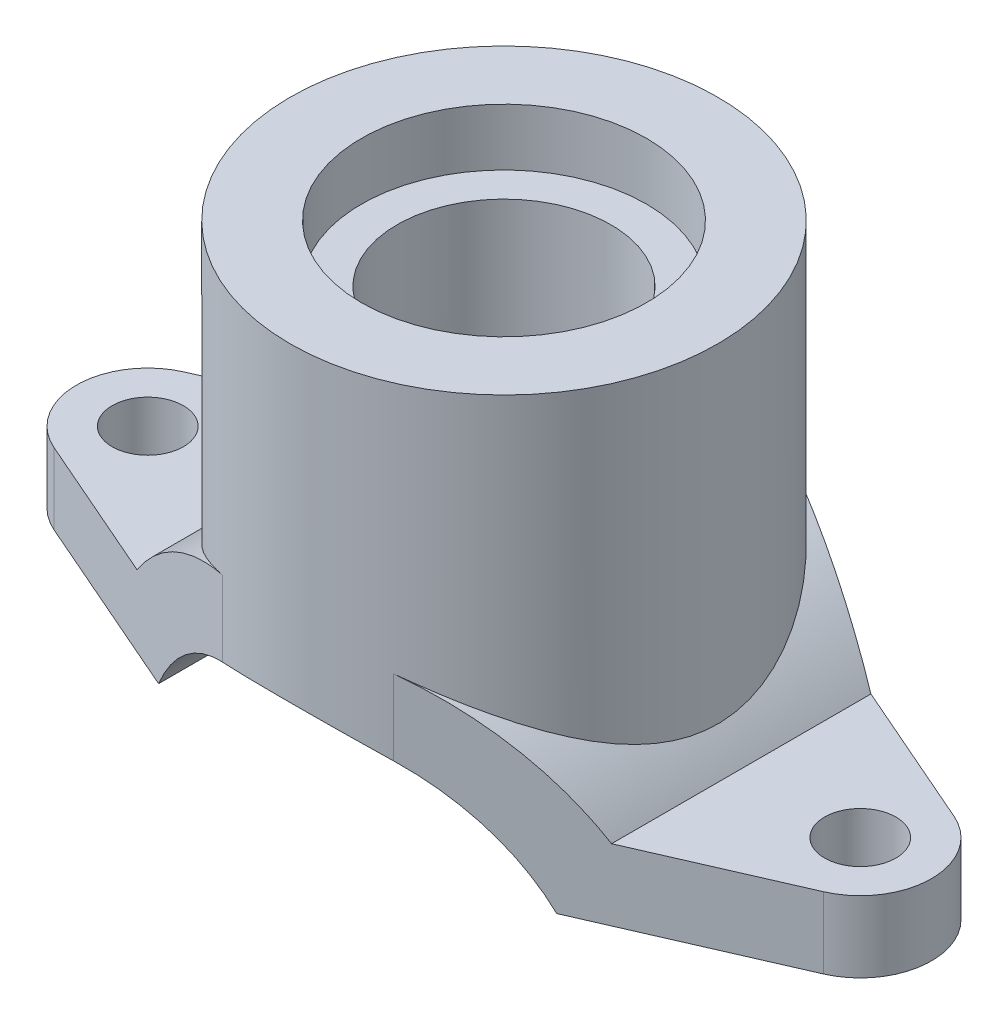
from build123d import *

# Parameters (mm, degrees)
BOSS_EXTRUDE3_DEPTH = 75
SKETCH2_OUTSIDE_W   = 370.368
SKETCH2_OUTSIDE_H   = 220.368
SKETCH2_OUTSIDE_R   = 12.5
CUT_EXTRUDE1_DEPTH  = 150
BOSS_EXTRUDE4_REACH = 227
SKETCH3_R           = 75
SKETCH4_R           = 37.5
CUT_EXTRUDE2_DEPTH  = 150
SKETCH4_4_R         = 50
SKETCH4_4_R_2       = 37.5
CUT_EXTRUDE3_DEPTH  = 20


with BuildPart() as part:
    # Sketch1 → Boss-Extrude3 (new, symmetric)
    with BuildSketch(Plane.XY):
        with BuildLine():
            Line((-150, 25), (-150, 0))
            Line((-150, 0), (-69.84983894, 0))
            ThreePointArc((-69.84983894, 0), (0, 41), (69.84983894, 0))
            Line((69.84983894, 0), (150, 0))
            Line((150, 0), (150, 25))
            Line((150, 25), (83.240615087, 25))
            ThreePointArc((83.240615087, 25), (0, 66), (-83.240615087, 25))
            Line((-83.240615087, 25), (-150, 25))
        make_face()
    extrude(amount=BOSS_EXTRUDE3_DEPTH, both=True)

    # Sketch2 outside → Cut-Extrude1 (cut)
    # profile 1 of 3: a face of its own
    with BuildSketch(Plane(origin=(0, 0, 0), x_dir=(1, 0, 0), z_dir=(0, 1, 0))):
        Rectangle(SKETCH2_OUTSIDE_W, SKETCH2_OUTSIDE_H)
        with BuildLine():
            Line((-135, -22.912878475), (-30, -68.738635424))
            ThreePointArc((-30, -68.738635424), (0, -75), (30, -68.738635424))
            Line((30, -68.738635424), (135, -22.912878475))
            ThreePointArc((135, -22.912878475), (150, 0), (135, 22.912878475))
            Line((135, 22.912878475), (30, 68.738635424))
            ThreePointArc((30, 68.738635424), (0, 75), (-30, 68.738635424))
            Line((-30, 68.738635424), (-135, 22.912878475))
            ThreePointArc((-135, 22.912878475), (-150, 0), (-135, -22.912878475))
        make_face(mode=Mode.SUBTRACT)
    # profile 2 of 3: a face of its own
    with BuildSketch(Plane(origin=(0, 0, 0), x_dir=(1, 0, 0), z_dir=(0, 1, 0))):
        with Locations((125, 0)):
            Circle(SKETCH2_OUTSIDE_R)
    # profile 3 of 3: a face of its own
    with BuildSketch(Plane(origin=(0, 0, 0), x_dir=(1, 0, 0), z_dir=(0, 1, 0))):
        with Locations((-125, 0)):
            Circle(SKETCH2_OUTSIDE_R)
    extrude(amount=CUT_EXTRUDE1_DEPTH, mode=Mode.SUBTRACT)

    # Sketch3 → Boss-Extrude4 (add, up to next)
    with BuildSketch(Plane(origin=(0, 150, 0), x_dir=(1, 0, 0), z_dir=(0, 1, 0)), mode=Mode.PRIVATE) as boss_extrude4_sk1:
        Circle(SKETCH3_R)
    boss_extrude4_tool1 = extrude(boss_extrude4_sk1.sketch, amount=-BOSS_EXTRUDE4_REACH, mode=Mode.PRIVATE) - part.part
    add(boss_extrude4_tool1.solids().sort_by_distance((0, 150, 0))[0])

    # Sketch4 → Cut-Extrude2 (cut)
    with BuildSketch(Plane(origin=(0, 150, 0), x_dir=(1, 0, 0), z_dir=(0, 1, 0))):
        Circle(SKETCH4_R)
    extrude(amount=-CUT_EXTRUDE2_DEPTH, mode=Mode.SUBTRACT)

    # Sketch4<4> → Cut-Extrude3 (cut)
    with BuildSketch(Plane(origin=(0, 150, 0), x_dir=(1, 0, 0), z_dir=(0, 1, 0))):
        Circle(SKETCH4_4_R)
        Circle(SKETCH4_4_R_2, mode=Mode.SUBTRACT)
    extrude(amount=-CUT_EXTRUDE3_DEPTH, mode=Mode.SUBTRACT)


solid = part.part
